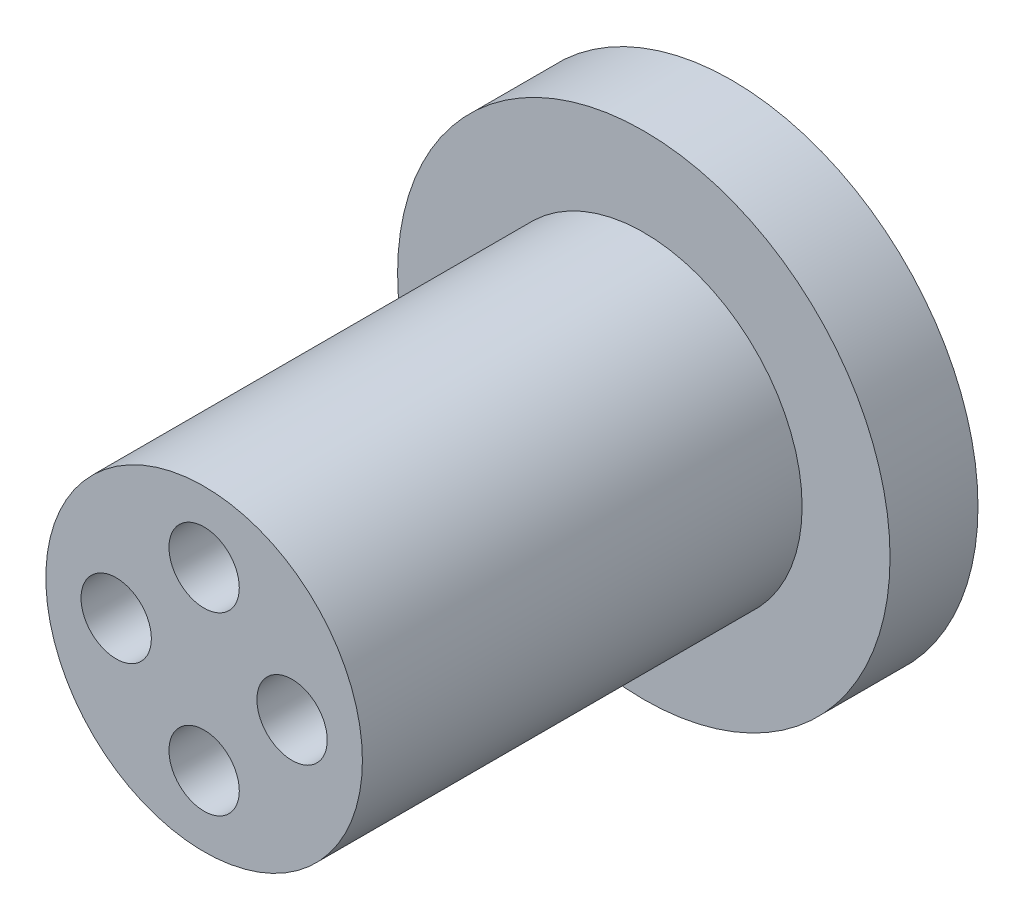
from build123d import *

# Parameters (mm, degrees)
SKETCH1_R           = 7
BOSS_EXTRUDE1_DEPTH = 2.5
SKETCH2_R           = 4.5
BOSS_EXTRUDE2_DEPTH = 12.5
SKETCH3_R           = 1
CUT_EXTRUDE1_DEPTH  = 5


with BuildPart() as part:
    # Sketch1 → Boss-Extrude1 (new body)
    with BuildSketch(Plane.XY):
        Circle(SKETCH1_R)
    extrude(amount=BOSS_EXTRUDE1_DEPTH)

    # Sketch2 → Boss-Extrude2 (add)
    with BuildSketch(Plane.XY.offset(2.5)):
        Circle(SKETCH2_R)
    extrude(amount=BOSS_EXTRUDE2_DEPTH)

    # Sketch3 → Cut-Extrude1 (cut)
    with BuildSketch(Plane.XY.offset(15)):
        with Locations((0, 2.5)):
            Circle(SKETCH3_R)
        with Locations((2.5, 0)):
            Circle(SKETCH3_R)
        with Locations((0, -2.5)):
            Circle(SKETCH3_R)
        with Locations((-2.5, 0)):
            Circle(SKETCH3_R)
    extrude(amount=-CUT_EXTRUDE1_DEPTH, mode=Mode.SUBTRACT)


solid = part.part
